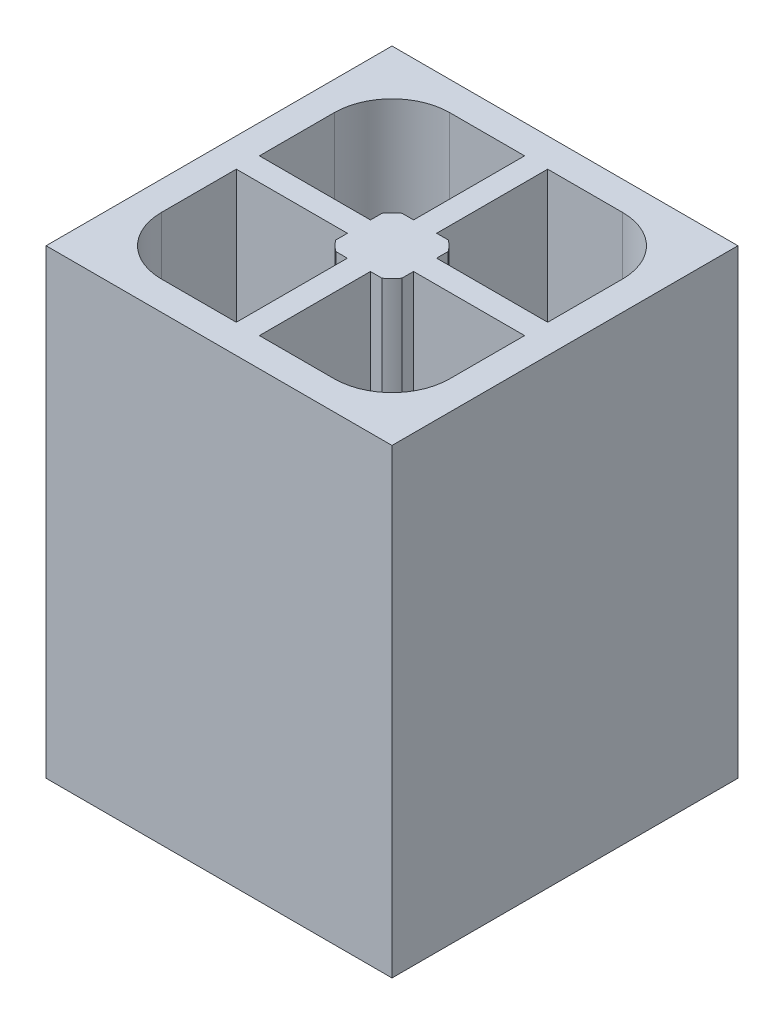
from build123d import *

# Parameters (mm, degrees)
SKETCH2_W           = 60
SKETCH2_H           = 60
BOSS_EXTRUDE2_DEPTH = 80
CUT_EXTRUDE1_DEPTH  = 80
SKETCH4_R           = 7
BOSS_EXTRUDE3_DEPTH = 80
SKETCH5_W           = 2
SKETCH5_H           = 19.255437353
SKETCH5_W_2         = 19.265898102
SKETCH5_H_2         = 2
CUT_EXTRUDE2_DEPTH  = 80


with BuildPart() as part:
    # Sketch2 → Boss-Extrude2 (new body)
    with BuildSketch(Plane(origin=(0, 0, 0), x_dir=(1, 0, 0), z_dir=(0, 1, 0))):
        with Locations((30, 30)):
            Rectangle(SKETCH2_W, SKETCH2_H)
    extrude(amount=BOSS_EXTRUDE2_DEPTH)

    # Sketch3 → Cut-Extrude1 (cut)
    with BuildSketch(Plane(origin=(0, 80, 0), x_dir=(1, 0, 0), z_dir=(0, 1, 0))):
        with BuildLine():
            Line((26, 55), (15, 55))
            ThreePointArc((15, 55), (7.928932188, 52.071067812), (5, 45))
            Line((5, 45), (5, 34))
            Line((5, 34), (26, 34))
            Line((26, 34), (26, 55))
        make_face()
        with BuildLine():
            Line((45, 55), (34, 55))
            Line((34, 55), (34, 34))
            Line((34, 34), (55, 34))
            Line((55, 34), (55, 45))
            ThreePointArc((55, 45), (52.071067812, 52.071067812), (45, 55))
        make_face()
        with BuildLine():
            Line((26, 26), (5, 26))
            Line((5, 26), (5, 15))
            ThreePointArc((5, 15), (7.928932188, 7.928932188), (15, 5))
            Line((15, 5), (26, 5))
            Line((26, 5), (26, 26))
        make_face()
        with BuildLine():
            Line((55, 15), (55, 26))
            Line((55, 26), (34, 26))
            Line((34, 26), (34, 5))
            Line((34, 5), (45, 5))
            ThreePointArc((45, 5), (52.071067812, 7.928932188), (55, 15))
        make_face()
    extrude(amount=-CUT_EXTRUDE1_DEPTH, mode=Mode.SUBTRACT)

    # Sketch4 → Boss-Extrude3 (add)
    with BuildSketch(Plane.XZ):
        with Locations((30, -30)):
            Circle(SKETCH4_R)
    extrude(amount=-BOSS_EXTRUDE3_DEPTH)

    # Sketch5 → Cut-Extrude2 (cut)
    with BuildSketch(Plane.XZ):
        with Locations((27, -14.627718677)):
            Rectangle(SKETCH5_W, SKETCH5_H)
        with Locations((33, -14.627718677)):
            Rectangle(SKETCH5_W, SKETCH5_H)
        with Locations((45.367050949, -27)):
            Rectangle(SKETCH5_W_2, SKETCH5_H_2)
        with Locations((45.367050949, -33)):
            Rectangle(SKETCH5_W_2, SKETCH5_H_2)
        with Locations((33, -45.372281324)):
            Rectangle(SKETCH5_W, SKETCH5_H)
        with Locations((27, -45.372281324)):
            Rectangle(SKETCH5_W, SKETCH5_H)
        with Locations((14.632949051, -33)):
            Rectangle(SKETCH5_W_2, SKETCH5_H_2)
        with Locations((14.632949051, -27)):
            Rectangle(SKETCH5_W_2, SKETCH5_H_2)
    extrude(amount=-CUT_EXTRUDE2_DEPTH, mode=Mode.SUBTRACT)


solid = part.part
